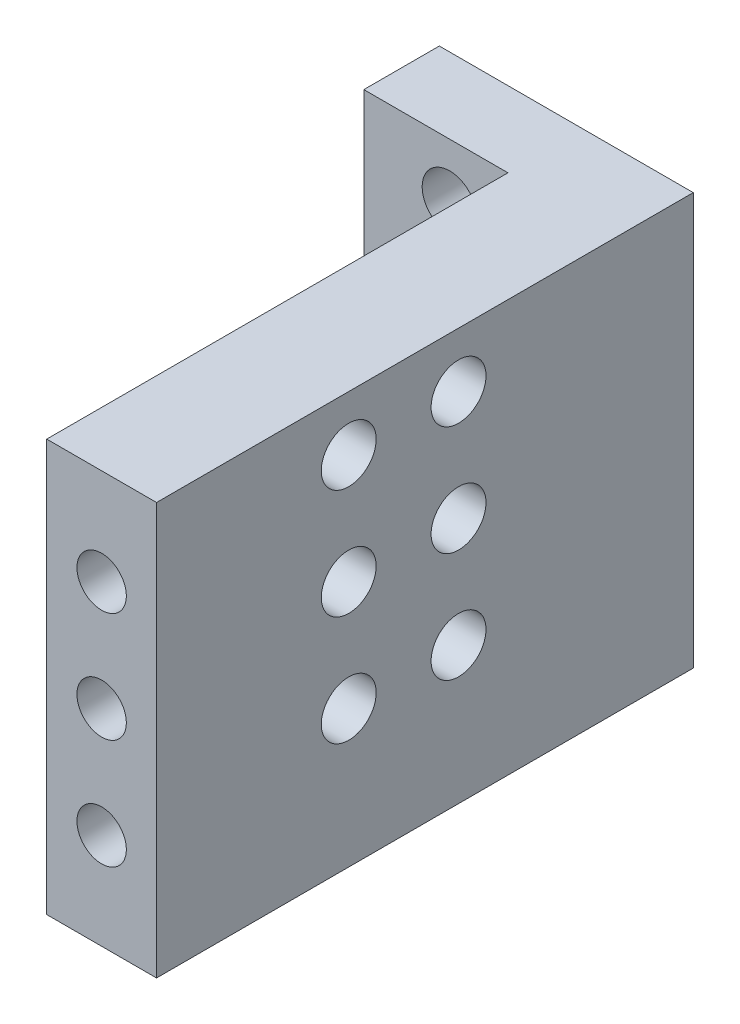
from build123d import *

# Parameters (mm, degrees)
EXTRUDE_1_DEPTH     = 30
SKETCH_2_R          = 2
CUT_EXTRUDE_1_DEPTH = 9
SKETCH_3_R          = 2
CUT_EXTRUDE_2_DEPTH = 9
SKETCH_4_R          = 1.8
CUT_EXTRUDE_3_DEPTH = 9


with BuildPart() as part:
    # 草圖1 → 填料-伸長1 (new body)
    with BuildSketch(Plane(origin=(0, 0, 0), x_dir=(1, 0, 0), z_dir=(0, 1, 0))):
        Polygon((0, 0), (0, 33.6), (-10.5, 33.6), (-10.5, 39.1), (8, 39.1), (8, 0), align=None)
    extrude(amount=EXTRUDE_1_DEPTH)

    # 草圖2 → 除料-伸長1 (cut)
    with BuildSketch(Plane(origin=(0, 0, -39.1), x_dir=(-1, 0, 0), z_dir=(0, 0, -1))):
        with Locations((4.25, 26)):
            Circle(SKETCH_2_R)
        with Locations((4.25, 18)):
            Circle(SKETCH_2_R)
        with Locations((4.25, 10)):
            Circle(SKETCH_2_R)
    extrude(amount=-CUT_EXTRUDE_1_DEPTH, mode=Mode.SUBTRACT)

    # 草圖3 → 除料-伸長2 (cut)
    with BuildSketch(Plane(origin=(8, 0, 0), x_dir=(0, 0, -1), z_dir=(1, 0, 0))):
        with Locations((14, 26)):
            Circle(SKETCH_3_R)
        with Locations((14, 18)):
            Circle(SKETCH_3_R)
        with Locations((14, 10)):
            Circle(SKETCH_3_R)
        with Locations((22, 26)):
            Circle(SKETCH_3_R)
        with Locations((22, 18)):
            Circle(SKETCH_3_R)
        with Locations((22, 10)):
            Circle(SKETCH_3_R)
    extrude(amount=-CUT_EXTRUDE_2_DEPTH, mode=Mode.SUBTRACT)

    # 草圖4 → 除料-伸長3 (cut)
    with BuildSketch(Plane.XY):
        with Locations((4, 23)):
            Circle(SKETCH_4_R)
        with Locations((4, 15)):
            Circle(SKETCH_4_R)
        with Locations((4, 7)):
            Circle(SKETCH_4_R)
    extrude(amount=-CUT_EXTRUDE_3_DEPTH, mode=Mode.SUBTRACT)


solid = part.part
